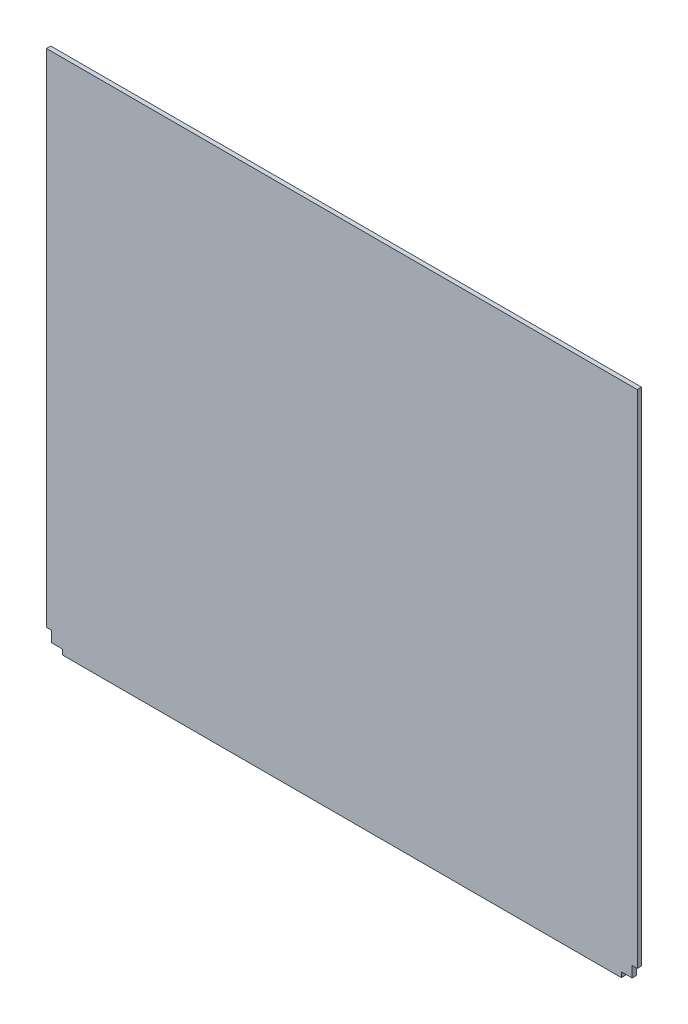
from build123d import *

# Parameters (mm, degrees)
BOSS_EXTRUDE1_DEPTH = 6.35


with BuildPart() as part:
    # Sketch1 → Boss-Extrude1 (new body)
    with BuildSketch(Plane.XY):
        Polygon((16.125088169, -7.62), (16.125088169, 0), (0, 0), (0, 16.125088169), (-7.62, 16.125088169), (-7.62, 762.508), (871.982, 762.508), (871.982, 16.125088169), (864.362, 16.125088169), (864.362, 0), (848.236911831, 0), (848.236911831, -7.62), align=None)
    extrude(amount=BOSS_EXTRUDE1_DEPTH)


solid = part.part
